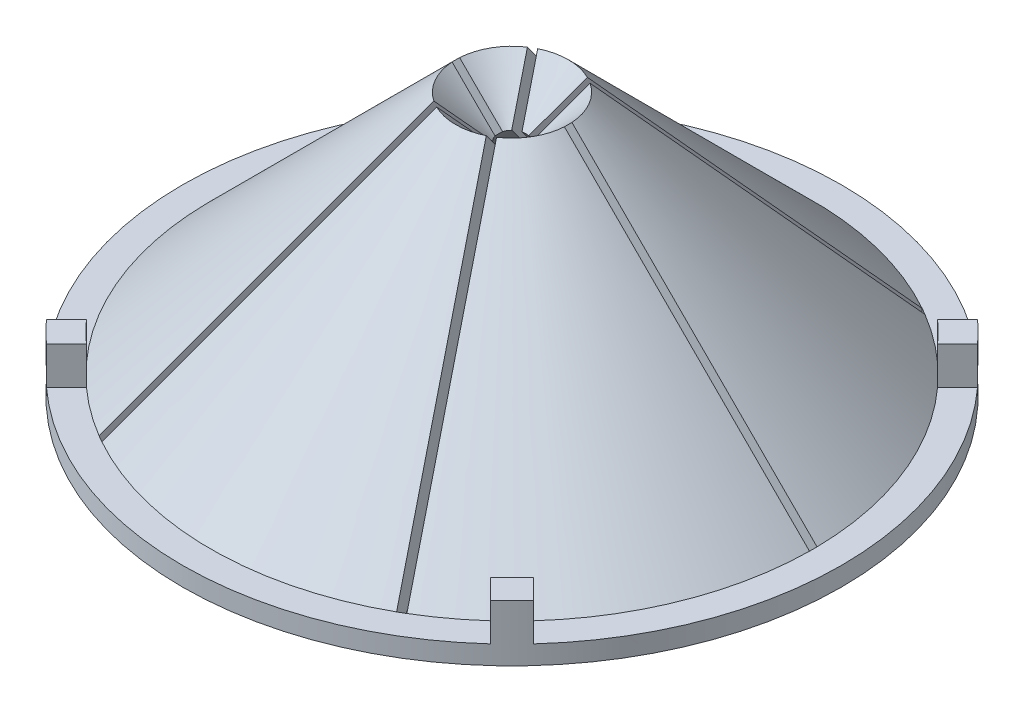
from build123d import *
from build123d.topology import SkipClean

# Parameters (mm, degrees)
CUT_EXTRUDE_1_REACH             = 16.541
CUT_EXTRUDE_1_DIRECTION_2_DEPTH = 10
PATTERN_CIRCULAR_1_COUNT        = 6
EXTRUDE_1_DEPTH                 = 1
PATTERN_CIRCULAR_2_COUNT        = 4


with BuildPart() as part:
    # 草图1 → 旋转2 (revolve)
    with BuildSketch(Plane.XY):
        Polygon((-1.494617613, 7.636753237), (-8, 1.13137085), (-8.75, 1.13137085), (-8.75, 0.63137085), (-6.2372583, 0.63137085), (-0.363246763, 6.505382387), align=None)
    revolve(axis=Axis((0, 35.786073675, 0), (0, -1, 0)))

    # 草图2 → 切除-拉伸1 (cut, up to next)
    with BuildSketch(Plane(origin=(0, 0, 0), x_dir=(1, 0, 0), z_dir=(0, 1, 0)), mode=Mode.PRIVATE) as cut_extrude_1_sk1:
        with BuildLine():
            Line((0, -0.1), (7.999374976, -0.1))
            ThreePointArc((7.999374976, -0.1), (8, 0), (7.999374976, 0.1))
            Line((7.999374976, 0.1), (0, 0.1))
            Line((0, 0.1), (0, -0.1))
        make_face()
    cut_extrude_1_tool1 = extrude(cut_extrude_1_sk1.sketch, amount=CUT_EXTRUDE_1_REACH, mode=Mode.PRIVATE) & part.part
    cut_extrude_1 = cut_extrude_1_tool1.solids().sort_by_distance((3.999896, 0, 0))[0]
    add(cut_extrude_1, mode=Mode.SUBTRACT)

    # 草图2 → 切除-拉伸1 direction 2 (cut)
    with BuildSketch(Plane(origin=(0, 0, 0), x_dir=(1, 0, 0), z_dir=(0, 1, 0))):
        with BuildLine():
            Line((0, -0.1), (7.999374976, -0.1))
            ThreePointArc((7.999374976, -0.1), (8, 0), (7.999374976, 0.1))
            Line((7.999374976, 0.1), (0, 0.1))
            Line((0, 0.1), (0, -0.1))
        make_face()
    cut_extrude_1_direction_2 = extrude(amount=-CUT_EXTRUDE_1_DIRECTION_2_DEPTH, mode=Mode.SUBTRACT)

    # 阵列(圆周)1: 切除-拉伸1, 切除-拉伸1 direction 2 ×6 about axis
    pattern_circular_1_axis = Axis((0, 1.13137085, 0), (0, 1, 0))
    add([cut_extrude_1.rotate(pattern_circular_1_axis, i * 360 / PATTERN_CIRCULAR_1_COUNT) for i in range(1, PATTERN_CIRCULAR_1_COUNT)], mode=Mode.SUBTRACT)
    add([cut_extrude_1_direction_2.rotate(pattern_circular_1_axis, i * 360 / PATTERN_CIRCULAR_1_COUNT) for i in range(1, PATTERN_CIRCULAR_1_COUNT)], mode=Mode.SUBTRACT)

    # 草图3 → 凸台-拉伸1 (add)
    with BuildSketch(Plane(origin=(0, 1.13137085, 0), x_dir=(1, 0, 0), z_dir=(0, 1, 0))):
        with BuildLine():
            Line((-5.366936044, 5.932621469), (-5.897873265, 6.46355869))
            ThreePointArc((-5.897873265, 6.46355869), (-6.187184335, 6.187184335), (-6.46355869, 5.897873265))
            Line((-6.46355869, 5.897873265), (-5.932621469, 5.366936044))
            ThreePointArc((-5.932621469, 5.366936044), (-5.656854249, 5.656854249), (-5.366936044, 5.932621469))
        make_face()
    extrude_1 = extrude(amount=EXTRUDE_1_DEPTH)

    # 阵列(圆周)2: 凸台-拉伸1 ×4 about axis
    with SkipClean():  # the faces are left unmerged after this step: merging them gives an invalid solid
        pattern_circular_2_axis = Axis((0, 1.13137085, 0), (0, 1, 0))
        for i in range(1, PATTERN_CIRCULAR_2_COUNT):
            add(extrude_1.rotate(pattern_circular_2_axis, i * 360 / PATTERN_CIRCULAR_2_COUNT))


solid = part.part
